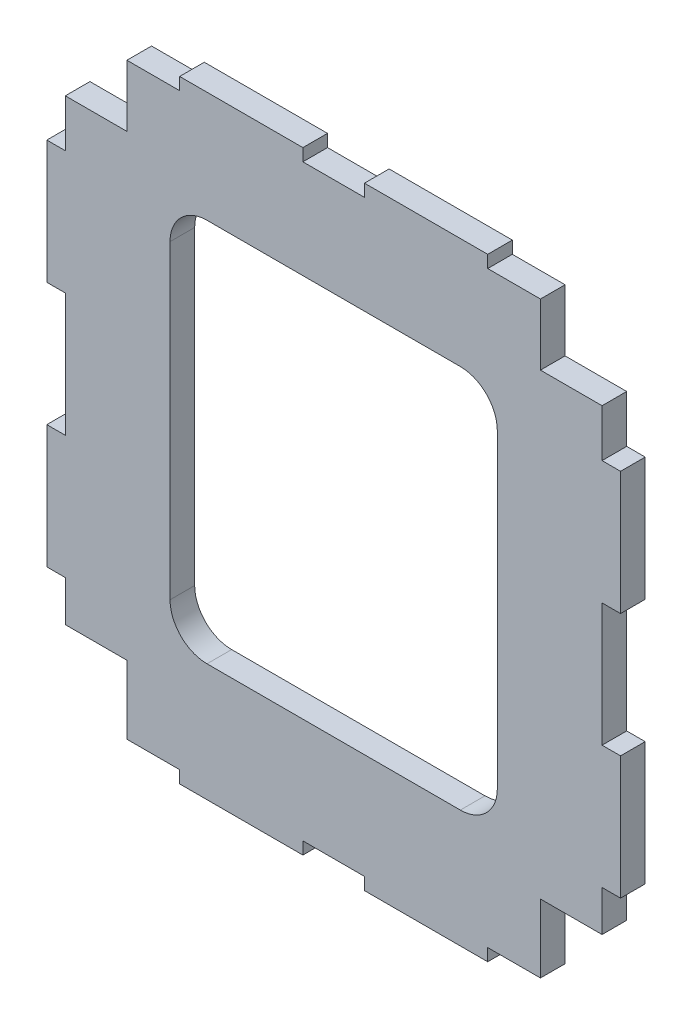
from build123d import *

# Parameters (mm, degrees)
EXTRUDE_1_DEPTH = 2


with BuildPart() as part:
    # Model → 凸台-拉伸1 (new body)
    with BuildSketch(Plane.XY):
        Polygon((21.619021943, 54.610495052), (25.899021943, 54.610495052), (25.899021943, 55.610850758), (35.899021943, 55.610850758), (35.899021943, 54.610495052), (40.899021943, 54.610495052), (40.899021943, 55.610850758), (50.899021943, 55.610850758), (50.899021943, 54.610495052), (55.179021943, 54.610495052), (55.179021943, 49.610495052), (60.179021943, 49.610495052), (60.179021943, 45.750495052), (61.679021943, 45.750495052), (61.679021943, 35.750495052), (60.179021943, 35.750495052), (60.179021943, 25.750495052), (61.679021943, 25.750495052), (61.679021943, 15.750495052), (60.179021943, 15.750495052), (60.179021943, 12.440495052), (55.179021943, 12.440495052), (55.179021943, 6.8876183), (50.899021943, 6.8876183), (50.899021943, 5.887262594), (40.899021943, 5.887262594), (40.899021943, 6.8876183), (35.899021943, 6.8876183), (35.899021943, 5.887262594), (25.899021943, 5.887262594), (25.899021943, 6.8876183), (21.619021943, 6.8876183), (21.619021943, 12.440495052), (16.619021943, 12.440495052), (16.619021943, 15.750495052), (15.119021943, 15.750495052), (15.119021943, 25.750495052), (16.619021943, 25.750495052), (16.619021943, 35.750495052), (15.119021943, 35.750495052), (15.119021943, 45.750495052), (16.619021943, 45.750495052), (16.619021943, 49.610495052), (21.619021943, 49.610495052), align=None)
        with BuildLine():
            Line((48.679021943, 46.610495052), (28.119021943, 46.610495052))
            ThreePointArc((28.119021943, 46.610495052), (25.9977016, 45.731815396), (25.119021943, 43.610495052))
            Line((25.119021943, 43.610495052), (25.119021943, 18.440495052))
            ThreePointArc((25.119021943, 18.440495052), (25.9977016, 16.319174709), (28.119021943, 15.440495052))
            Line((28.119021943, 15.440495052), (48.679021943, 15.440495052))
            ThreePointArc((48.679021943, 15.440495052), (50.800342287, 16.319174709), (51.679021943, 18.440495052))
            Line((51.679021943, 18.440495052), (51.679021943, 43.610495052))
            ThreePointArc((51.679021943, 43.610495052), (50.800342287, 45.731815396), (48.679021943, 46.610495052))
        make_face(mode=Mode.SUBTRACT)
    extrude(amount=EXTRUDE_1_DEPTH)


solid = part.part
